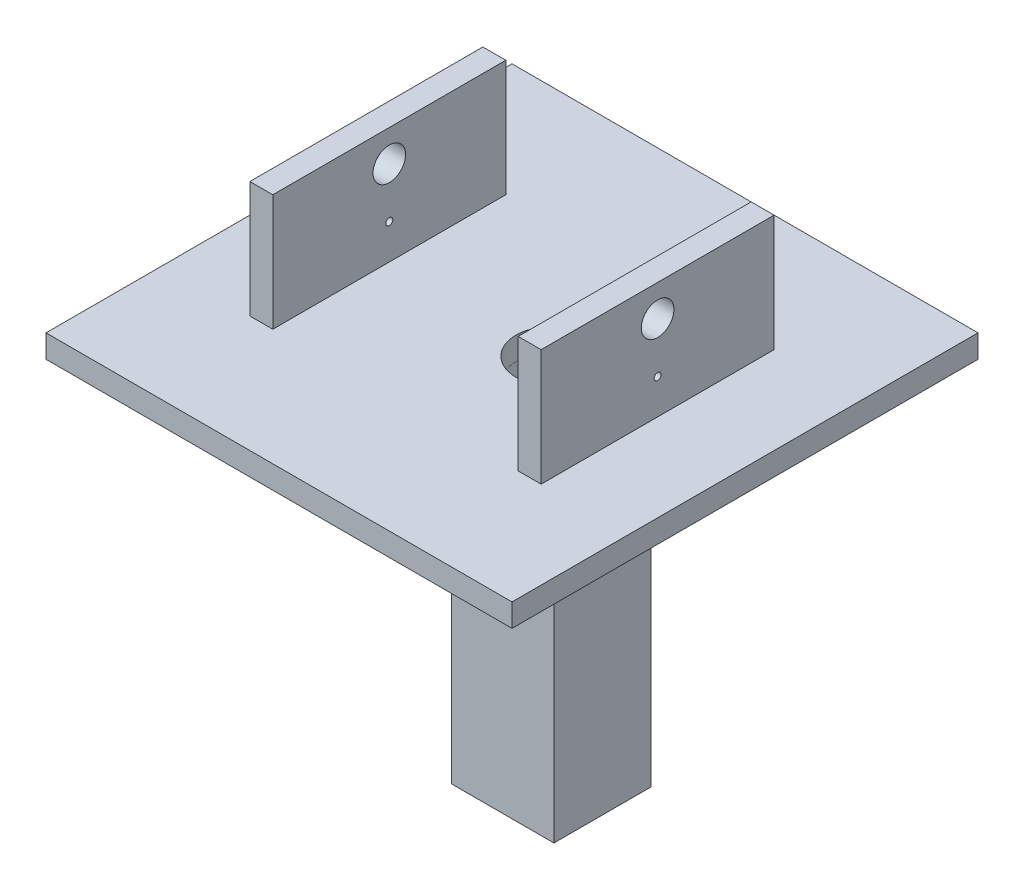
from build123d import *

# Parameters (mm, degrees)
SKETCH2_W           = 101.6
SKETCH2_H           = 101.6
BOSS_EXTRUDE2_DEPTH = 5
SKETCH3_W           = 5
SKETCH3_H           = 50.8
BOSS_EXTRUDE3_DEPTH = 25.4
SKETCH4_W           = 5
SKETCH4_H           = 50.8
BOSS_EXTRUDE4_DEPTH = 25.4
SKETCH8_R           = 3.556
CUT_EXTRUDE1_DEPTH  = 135.392047756
CUT_EXTRUDE2_REACH  = 136.392
SKETCH9_R           = 0.762
SKETCH11_R          = 7.9502
CUT_EXTRUDE3_DEPTH  = 146.911891222
CUT_EXTRUDE5_REACH  = 136.392
SKETCH18_R          = 0.762
SKETCH19_W          = 22.350467385
SKETCH19_H          = 21.198381437
BOSS_EXTRUDE5_DEPTH = 76.2
SKETCH22_R          = 7.94
CUT_EXTRUDE7_DEPTH  = 72.2
SKETCH23_R          = 4.95
CUT_EXTRUDE8_DEPTH  = 179.909697893


with BuildPart() as part:
    # Sketch2 → Boss-Extrude2 (new body)
    with BuildSketch(Plane(origin=(0, 0, 0), x_dir=(1, 0, 0), z_dir=(0, 1, 0))):
        with Locations((50.8, -50.8)):
            Rectangle(SKETCH2_W, SKETCH2_H)
    extrude(amount=BOSS_EXTRUDE2_DEPTH)

    # Sketch3 → Boss-Extrude3 (add)
    with BuildSketch(Plane(origin=(0, 5, 0), x_dir=(1, 0, 0), z_dir=(0, 1, 0))):
        with Locations((21.55, -50.8)):
            Rectangle(SKETCH3_W, SKETCH3_H)
    extrude(amount=BOSS_EXTRUDE3_DEPTH)

    # Sketch4 → Boss-Extrude4 (add)
    with BuildSketch(Plane(origin=(0, 5, 0), x_dir=(1, 0, 0), z_dir=(0, 1, 0))):
        with Locations((80.05, -50.8)):
            Rectangle(SKETCH4_W, SKETCH4_H)
    extrude(amount=BOSS_EXTRUDE4_DEPTH)

    # Sketch8 → Cut-Extrude1 (cut, through all)
    with BuildSketch(Plane.ZY.offset(-19.05)):
        with Locations((50.8, 23.542)):
            Circle(SKETCH8_R)
    extrude(amount=-CUT_EXTRUDE1_DEPTH, mode=Mode.SUBTRACT)

    # Sketch9 → Cut-Extrude2 (cut, up to next)
    with BuildSketch(Plane(origin=(82.55, 0, 0), x_dir=(0, 0, -1), z_dir=(1, 0, 0)), mode=Mode.PRIVATE) as cut_extrude2_sk1:
        with Locations((-50.8, 12.62)):
            Circle(SKETCH9_R)
    cut_extrude2_tool1 = extrude(cut_extrude2_sk1.sketch, amount=-CUT_EXTRUDE2_REACH, mode=Mode.PRIVATE) & part.part
    add(cut_extrude2_tool1.solids().sort_by_distance((82.55, 12.62, 50.8))[0], mode=Mode.SUBTRACT)

    # Sketch11 → Cut-Extrude3 (cut, through all)
    with BuildSketch(Plane(origin=(0, 5, 0), x_dir=(1, 0, 0), z_dir=(0, 1, 0))):
        with Locations(Location((59.61, -50.8, 0), (0, 0, 270))):
            Circle(SKETCH11_R)
    extrude(amount=-CUT_EXTRUDE3_DEPTH, mode=Mode.SUBTRACT)

    # Sketch18 → Cut-Extrude5 (cut, up to next)
    with BuildSketch(Plane.ZY.offset(-19.05), mode=Mode.PRIVATE) as cut_extrude5_sk1:
        with Locations(Location((50.8, 12.62, 0), (0, 0, 180))):
            Circle(SKETCH18_R)
    cut_extrude5_tool1 = extrude(cut_extrude5_sk1.sketch, amount=-CUT_EXTRUDE5_REACH, mode=Mode.PRIVATE) & part.part
    add(cut_extrude5_tool1.solids().sort_by_distance((19.05, 12.62, 50.8))[0], mode=Mode.SUBTRACT)

    # Sketch19 → Boss-Extrude5 (add)
    with BuildSketch(Plane.XZ):
        with Locations((59.324658632, 50.761526183)):
            Rectangle(SKETCH19_W, SKETCH19_H)
    extrude(amount=BOSS_EXTRUDE5_DEPTH)

    # Sketch22 → Cut-Extrude7 (cut)
    with BuildSketch(Plane(origin=(0, 0, 0), x_dir=(1, 0, 0), z_dir=(0, 1, 0))):
        with Locations(Location((59.61, -50.8, 0), (0, 0, 270))):
            Circle(SKETCH22_R)
    extrude(amount=-CUT_EXTRUDE7_DEPTH, mode=Mode.SUBTRACT)

    # Sketch23 → Cut-Extrude8 (cut, through all)
    with BuildSketch(Plane.XZ.offset(76.2)):
        with Locations(Location((59.61, 50.8, 0), (0, 0, 270))):
            Circle(SKETCH23_R)
    extrude(amount=-CUT_EXTRUDE8_DEPTH, mode=Mode.SUBTRACT)


solid = part.part
